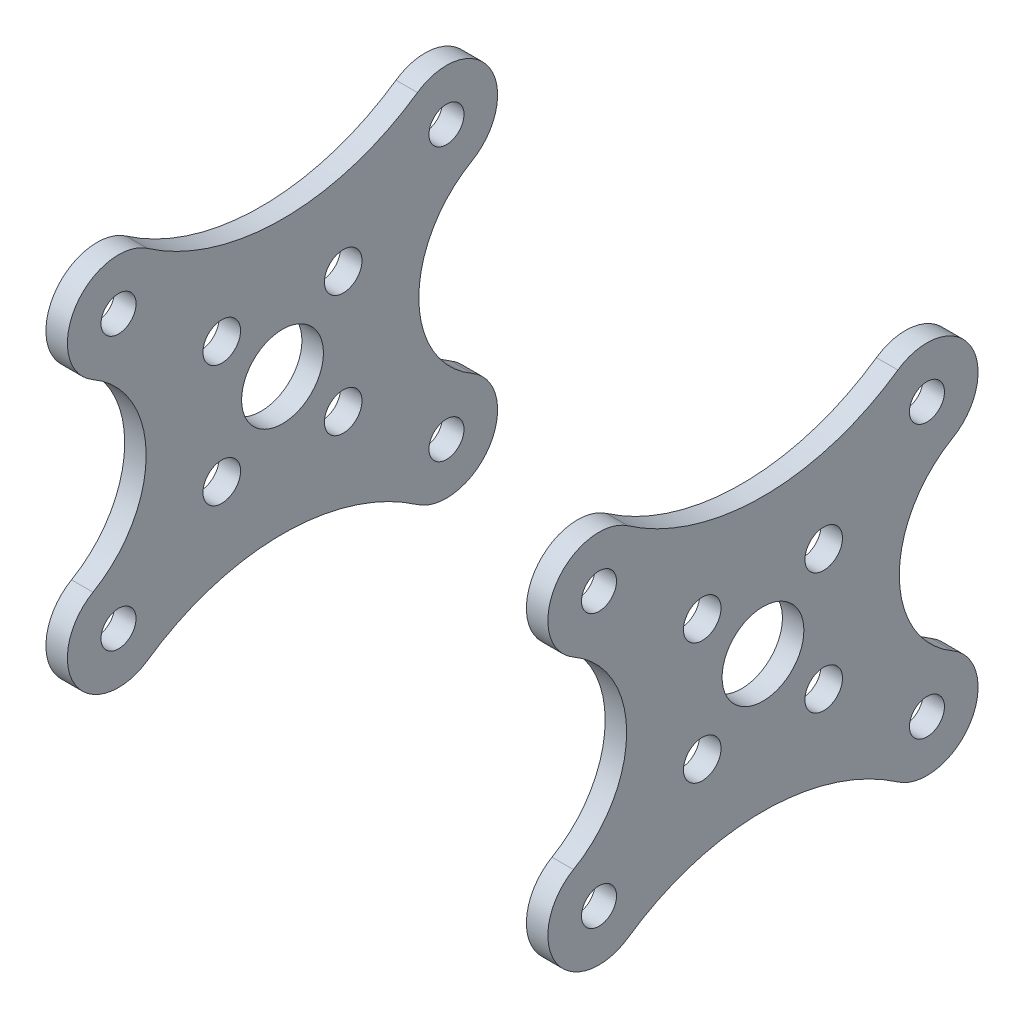
from build123d import *

# Parameters (mm, degrees)
BOSS_EXTRUDE1_DEPTH   = 2.000000064
SKETCH2_R             = 1.75
SKETCH2_R_2           = 3.81
CUT_EXTRUDE1_DEPTH    = 2.000000064
F_4_CLEARANCE_HOLE1_D = 3.2639


with BuildPart() as part:
    # Sketch1 → Boss-Extrude1 (new body)
    with BuildSketch(Plane(origin=(23.379999952, 0, 0), x_dir=(0, 0, -1), z_dir=(1, 0, 0))):
        with BuildLine():
            ThreePointArc((-12.433728752, 16.618705799), (-5.701455305, 15.24451716), (-7.348924048, 8.573854006))
            ThreePointArc((-7.348924048, 8.573854006), (-12.303125, 0), (-7.348924048, -8.573854006))
            ThreePointArc((-7.348924048, -8.573854006), (-5.701455305, -15.24451716), (-12.433728752, -16.618705799))
            ThreePointArc((-12.433728752, -16.618705799), (-25.003125, -12.7), (-37.572521248, -16.618705799))
            ThreePointArc((-37.572521248, -16.618705799), (-44.304794695, -15.24451716), (-42.657325952, -8.573854006))
            ThreePointArc((-42.657325952, -8.573854006), (-37.703125, 0), (-42.657325952, 8.573854006))
            ThreePointArc((-42.657325952, 8.573854006), (-44.304794695, 15.24451716), (-37.572521248, 16.618705799))
            ThreePointArc((-37.572521248, 16.618705799), (-25.003125, 12.7), (-12.433728752, 16.618705799))
        make_face()
    extrude(amount=-BOSS_EXTRUDE1_DEPTH)

    # Sketch2 → Cut-Extrude1 (cut)
    with BuildSketch(Plane.ZY.offset(-21.379999888)):
        with Locations((19.346270749, 5.656854251)):
            Circle(SKETCH2_R)
        with Locations((19.346270749, -5.656854251)):
            Circle(SKETCH2_R)
        with Locations((30.659979251, -5.656854251)):
            Circle(SKETCH2_R)
        with Locations((30.659979251, 5.656854251)):
            Circle(SKETCH2_R)
        with Locations((25.003125, 0)):
            Circle(SKETCH2_R_2)
    extrude(amount=-CUT_EXTRUDE1_DEPTH, mode=Mode.SUBTRACT)

    # #4 Clearance Hole1 (through all)
    with Locations(Plane(origin=(21.379999888, 0, 0), x_dir=(0, 0, -1), z_dir=(-1, 0, 0))):
        with Locations((-40.279022884, -12.7), (-9.727227116, -12.7), (-9.727227116, 12.7), (-40.279022884, 12.7)):
            Hole(F_4_CLEARANCE_HOLE1_D / 2)


with BuildPart() as body_2:
    # Mirror1: mirrored copy
    add(part.part.mirror(Plane(origin=(0, 0, 0), x_dir=(0, 0, 1), z_dir=(1, 0, 0))))


solid = Compound([part.part, body_2.part])
